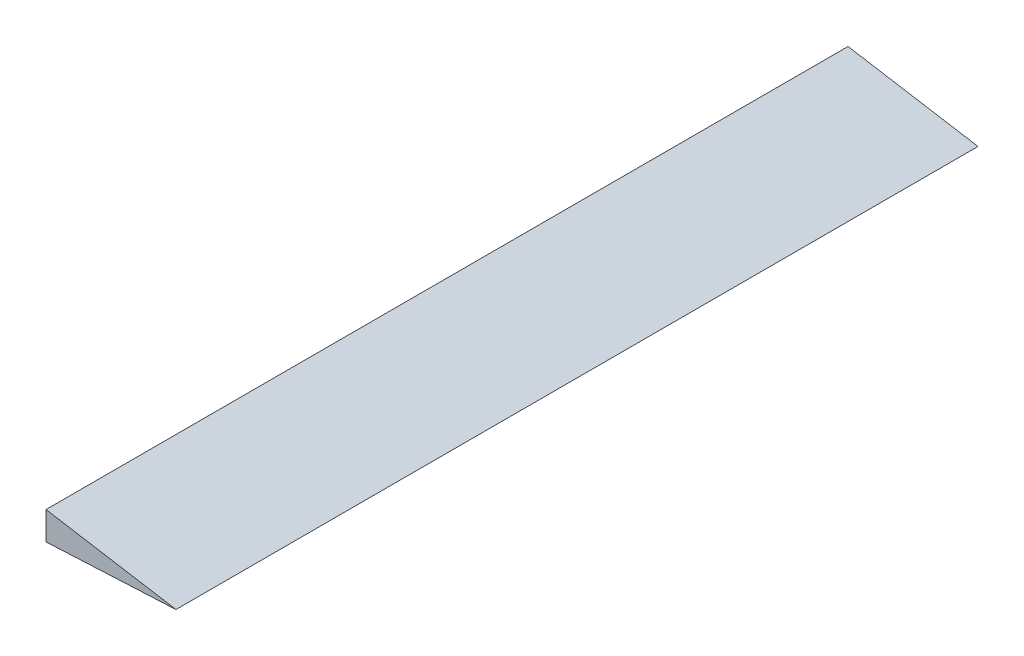
from build123d import *

# Parameters (mm, degrees)
BOSS_EXTRUDE2_DEPTH = 313.51728


with BuildPart() as part:
    # Sketch2 → Boss-Extrude2 (new body)
    with BuildSketch(Plane(origin=(0, 0, -761.999746), x_dir=(-1, 0, 0), z_dir=(0, 0, -1))):
        Polygon((-306.8495768, -2.516115741), (-306.8495768, 8.449856001), (-357.6495768, 0), align=None)
    extrude(amount=-BOSS_EXTRUDE2_DEPTH)


solid = part.part
